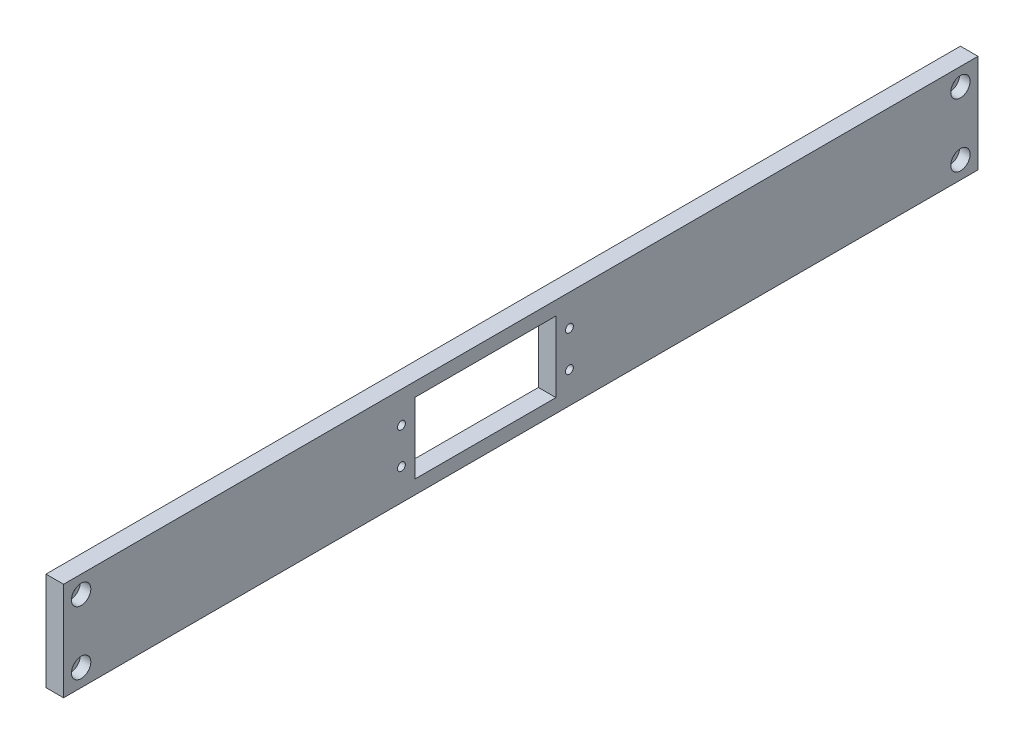
from build123d import *

# Parameters (mm, degrees)
SKETCH1_W                                  = 5
SKETCH1_H                                  = 260.2
BOSS_EXTRUDE1_DEPTH                        = 28
SKETCH2_W                                  = 40.12
SKETCH2_H                                  = 20.12
CUT_EXTRUDE1_DEPTH                         = 134.172857595
SKETCH3_R                                  = 1.125
CUT_EXTRUDE2_DEPTH                         = 134.172857595
SKETCH4_R                                  = 2.75
CUT_EXTRUDE3_DEPTH                         = 3
SKETCH5_R                                  = 1.55
CUT_EXTRUDE4_DEPTH                         = 134.112771739
MIRROR2_AT_THE_SECOND_PLANE_COPY_1_SKETC_R = 2.75
MIRROR2_AT_THE_SECOND_PLANE_COPY_1_DEPTH   = 3
MIRROR2_AT_THE_SECOND_PLANE_COPY_2_SKETC_R = 1.55
MIRROR2_AT_THE_SECOND_PLANE_COPY_2_DEPTH   = 134.112771739


with BuildPart() as part:
    # Sketch1 → Boss-Extrude1 (new body)
    with BuildSketch(Plane(origin=(0, 0, 0), x_dir=(1, 0, 0), z_dir=(0, 1, 0))):
        Rectangle(SKETCH1_W, SKETCH1_H)
    extrude(amount=BOSS_EXTRUDE1_DEPTH)

    # Sketch2 → Cut-Extrude1 (cut, through all)
    with BuildSketch(Plane(origin=(2.5, 0, 0), x_dir=(0, 0, -1), z_dir=(1, 0, 0))):
        with Locations((-10.06, 14)):
            Rectangle(SKETCH2_W, SKETCH2_H)
    extrude(amount=-CUT_EXTRUDE1_DEPTH, mode=Mode.SUBTRACT)

    # Sketch3 → Cut-Extrude2 (cut, through all)
    with BuildSketch(Plane(origin=(2.5, 0, 0), x_dir=(0, 0, -1), z_dir=(1, 0, 0))):
        with Locations((-33.96, 19.1)):
            Circle(SKETCH3_R)
        with Locations((-33.96, 8.9)):
            Circle(SKETCH3_R)
        with Locations((13.84, 19.1)):
            Circle(SKETCH3_R)
        with Locations((13.84, 8.9)):
            Circle(SKETCH3_R)
    extrude(amount=-CUT_EXTRUDE2_DEPTH, mode=Mode.SUBTRACT)

    # Sketch4 → Cut-Extrude3 (cut)
    with BuildSketch(Plane(origin=(2.5, 0, 0), x_dir=(0, 0, -1), z_dir=(1, 0, 0))):
        with Locations((-125.1, 23)):
            Circle(SKETCH4_R)
    cut_extrude3 = extrude(amount=-CUT_EXTRUDE3_DEPTH, mode=Mode.SUBTRACT)

    # Sketch5 → Cut-Extrude4 (cut, through all)
    with BuildSketch(Plane(origin=(-0.5, 0, 0), x_dir=(0, 0, -1), z_dir=(1, 0, 0))):
        with Locations((-125.1, 23)):
            Circle(SKETCH5_R)
    cut_extrude4 = extrude(amount=-CUT_EXTRUDE4_DEPTH, mode=Mode.SUBTRACT)

    # Mirror2: Cut-Extrude3, Cut-Extrude4 across plane
    add(cut_extrude3.mirror(Plane.XY), mode=Mode.SUBTRACT)
    add(cut_extrude4.mirror(Plane.XY), mode=Mode.SUBTRACT)

    # Mirror2 at the second plane: Cut-Extrude3, Cut-Extrude4 across plane
    add(cut_extrude3.mirror(Plane.ZX.offset(14)), mode=Mode.SUBTRACT)
    add(cut_extrude4.mirror(Plane.ZX.offset(14)), mode=Mode.SUBTRACT)

    # Mirror2 at the second plane copy 1 sketc → Mirror2 at the second plane copy 1 (cut)
    with BuildSketch(Plane(origin=(2.5, 28, 0), x_dir=(0, 0, 1), z_dir=(1, 0, 0))):
        with Locations((-125.1, 23)):
            Circle(MIRROR2_AT_THE_SECOND_PLANE_COPY_1_SKETC_R)
    extrude(amount=-MIRROR2_AT_THE_SECOND_PLANE_COPY_1_DEPTH, mode=Mode.SUBTRACT)

    # Mirror2 at the second plane copy 2 sketc → Mirror2 at the second plane copy 2 (cut, through all)
    with BuildSketch(Plane(origin=(-0.5, 28, 0), x_dir=(0, 0, 1), z_dir=(1, 0, 0))):
        with Locations((-125.1, 23)):
            Circle(MIRROR2_AT_THE_SECOND_PLANE_COPY_2_SKETC_R)
    extrude(amount=-MIRROR2_AT_THE_SECOND_PLANE_COPY_2_DEPTH, mode=Mode.SUBTRACT)


solid = part.part
